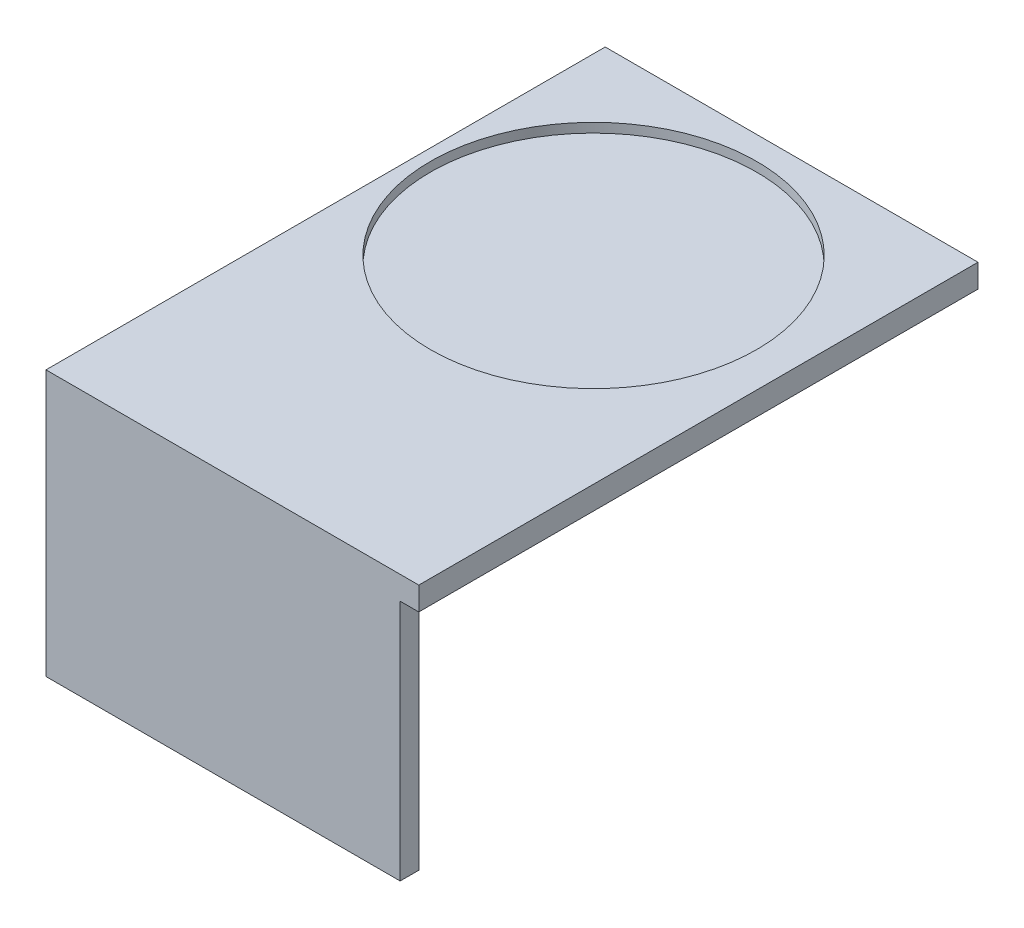
from build123d import *

# Parameters (mm, degrees)
SKETCH1_W           = 80
SKETCH1_H           = 120
BOSS_EXTRUDE1_DEPTH = 5
SKETCH2_W           = 76
SKETCH2_H           = 4
BOSS_EXTRUDE2_DEPTH = 52
SKETCH4_R           = 3.41
BOSS_EXTRUDE3_DEPTH = 4
SKETCH5_R           = 35
CUT_EXTRUDE1_DEPTH  = 2


with BuildPart() as part:
    # Sketch1 → Boss-Extrude1 (new body)
    with BuildSketch(Plane(origin=(0, 0, 0), x_dir=(1, 0, 0), z_dir=(0, 1, 0))):
        with Locations((2.5, 20)):
            Rectangle(SKETCH1_W, SKETCH1_H)
    extrude(amount=BOSS_EXTRUDE1_DEPTH)

    # Sketch2 → Boss-Extrude2 (add)
    with BuildSketch(Plane.XZ):
        with Locations((0.5, 38)):
            Rectangle(SKETCH2_W, SKETCH2_H)
    extrude(amount=BOSS_EXTRUDE2_DEPTH)

    # Sketch4 → Boss-Extrude3 (add)
    # profile 1 of 2: a face of its own
    with BuildSketch(Plane.ZY.offset(37.5)):
        with BuildLine():
            Line((-30, 0), (-20, 0))
            Line((-20, 0), (-20, -5))
            ThreePointArc((-20, -5), (-25, -10), (-30, -5))
            Line((-30, -5), (-30, 0))
        make_face()
        with Locations((-25, -5)):
            Circle(SKETCH4_R, mode=Mode.SUBTRACT)
    # profile 2 of 2: a face of its own
    with BuildSketch(Plane.ZY.offset(37.5)):
        with BuildLine():
            Line((16, 0), (16, -5))
            ThreePointArc((16, -5), (16.965508893, -7.953452473), (19.489152604, -9.766271094))
            Line((19.489152604, -9.766271094), (36, -15))
            Line((36, -15), (36, 0))
            Line((36, 0), (26, 0))
            Line((26, 0), (16, 0))
        make_face()
        with Locations(Location((21, -5, 0), (0, 0, 180))):
            Circle(SKETCH4_R, mode=Mode.SUBTRACT)
    extrude(amount=-BOSS_EXTRUDE3_DEPTH)

    # Sketch5 → Cut-Extrude1 (cut)
    with BuildSketch(Plane(origin=(0, 5, 0), x_dir=(1, 0, 0), z_dir=(0, 1, 0))):
        with Locations(Location((0, 40, 0), (0, 0, 270))):
            Circle(SKETCH5_R)
    extrude(amount=-CUT_EXTRUDE1_DEPTH, mode=Mode.SUBTRACT)


solid = part.part
